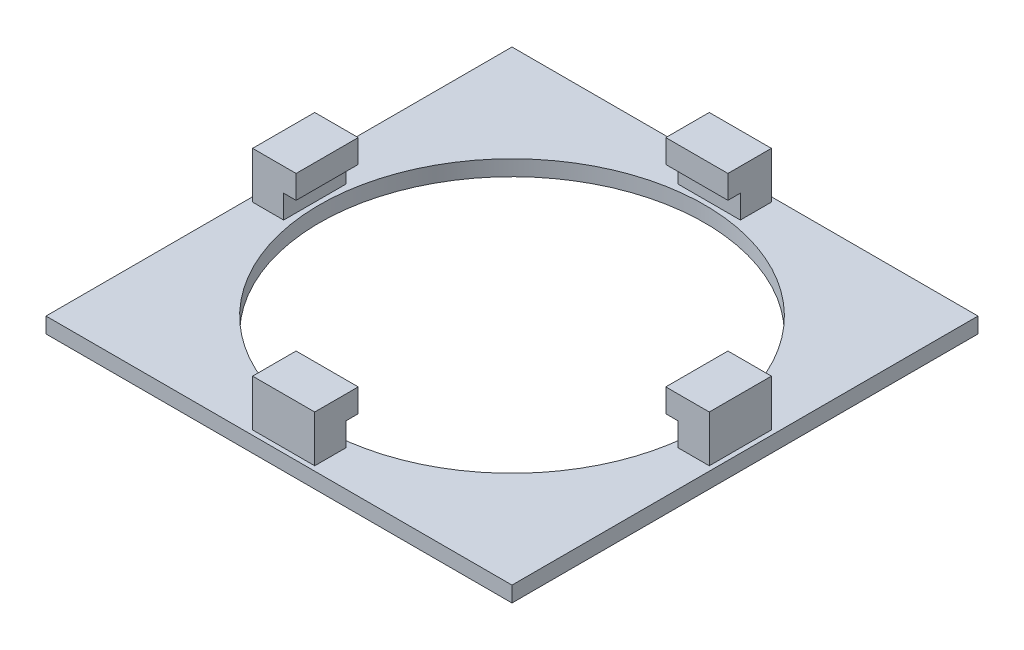
from build123d import *

# Parameters (mm, degrees)
SKETCH1_W           = 30
SKETCH1_H           = 30
BOSS_EXTRUDE1_DEPTH = 1
SKETCH2_R           = 12.4
CUT_EXTRUDE1_DEPTH  = 22.236760582
SKETCH4_W           = 2
SKETCH4_H           = 4
SKETCH4_W_2         = 4
SKETCH4_H_2         = 2
BOSS_EXTRUDE2_DEPTH = 2
SKETCH5_W           = 4
SKETCH5_H           = 0.5
BOSS_EXTRUDE3_DEPTH = 0.8
SKETCH6_W           = 4
SKETCH6_H           = 0.5
BOSS_EXTRUDE4_DEPTH = 0.8
SKETCH7_W           = 4
SKETCH7_H           = 0.5
BOSS_EXTRUDE5_DEPTH = 0.8
SKETCH8_W           = 4
SKETCH8_H           = 0.5
BOSS_EXTRUDE6_DEPTH = 0.8
SKETCH9_W           = 2.8
SKETCH9_H           = 4
SKETCH9_W_2         = 4
SKETCH9_H_2         = 2.8
BOSS_EXTRUDE7_DEPTH = 1


with BuildPart() as part:
    # Sketch1 → Boss-Extrude1 (new body)
    with BuildSketch(Plane(origin=(0, 0, 0), x_dir=(1, 0, 0), z_dir=(0, 1, 0))):
        Rectangle(SKETCH1_W, SKETCH1_H)
    extrude(amount=BOSS_EXTRUDE1_DEPTH)

    # Sketch2 → Cut-Extrude1 (cut, through all)
    with BuildSketch(Plane(origin=(0, 1, 0), x_dir=(1, 0, 0), z_dir=(0, 1, 0))):
        with Locations(Location((0, 0, 0), (0, 0, 270))):
            Circle(SKETCH2_R)
    extrude(amount=-CUT_EXTRUDE1_DEPTH, mode=Mode.SUBTRACT)

    # Sketch4 → Boss-Extrude2 (add)
    with BuildSketch(Plane(origin=(0, 1, 0), x_dir=(1, 0, 0), z_dir=(0, 1, 0))):
        with Locations((13.7, 0)):
            Rectangle(SKETCH4_W, SKETCH4_H)
        with Locations((-13.7, 0)):
            Rectangle(SKETCH4_W, SKETCH4_H)
        with Locations((0, 13.7)):
            Rectangle(SKETCH4_W_2, SKETCH4_H_2)
        with Locations((0, -13.7)):
            Rectangle(SKETCH4_W_2, SKETCH4_H_2)
    extrude(amount=BOSS_EXTRUDE2_DEPTH)

    # Sketch5 → Boss-Extrude3 (add)
    with BuildSketch(Plane.ZY.offset(-12.7)):
        with Locations((0, 2.75)):
            Rectangle(SKETCH5_W, SKETCH5_H)
    extrude(amount=BOSS_EXTRUDE3_DEPTH)

    # Sketch6 → Boss-Extrude4 (add)
    with BuildSketch(Plane(origin=(0, 0, 12.7), x_dir=(-1, 0, 0), z_dir=(0, 0, -1))):
        with Locations((0, 2.75)):
            Rectangle(SKETCH6_W, SKETCH6_H)
    extrude(amount=BOSS_EXTRUDE4_DEPTH)

    # Sketch7 → Boss-Extrude5 (add)
    with BuildSketch(Plane(origin=(-12.7, 0, 0), x_dir=(0, 0, -1), z_dir=(1, 0, 0))):
        with Locations((0, 2.75)):
            Rectangle(SKETCH7_W, SKETCH7_H)
    extrude(amount=BOSS_EXTRUDE5_DEPTH)

    # Sketch8 → Boss-Extrude6 (add)
    with BuildSketch(Plane.XY.offset(-12.7)):
        with Locations((0, 2.75)):
            Rectangle(SKETCH8_W, SKETCH8_H)
    extrude(amount=BOSS_EXTRUDE6_DEPTH)

    # Sketch9 → Boss-Extrude7 (add)
    with BuildSketch(Plane(origin=(0, 3, 0), x_dir=(1, 0, 0), z_dir=(0, 1, 0))):
        with Locations((13.3, 0)):
            Rectangle(SKETCH9_W, SKETCH9_H)
        with Locations((-13.3, 0)):
            Rectangle(SKETCH9_W, SKETCH9_H)
        with Locations((0, -13.3)):
            Rectangle(SKETCH9_W_2, SKETCH9_H_2)
        with Locations((0, 13.3)):
            Rectangle(SKETCH9_W_2, SKETCH9_H_2)
    extrude(amount=BOSS_EXTRUDE7_DEPTH)


solid = part.part
